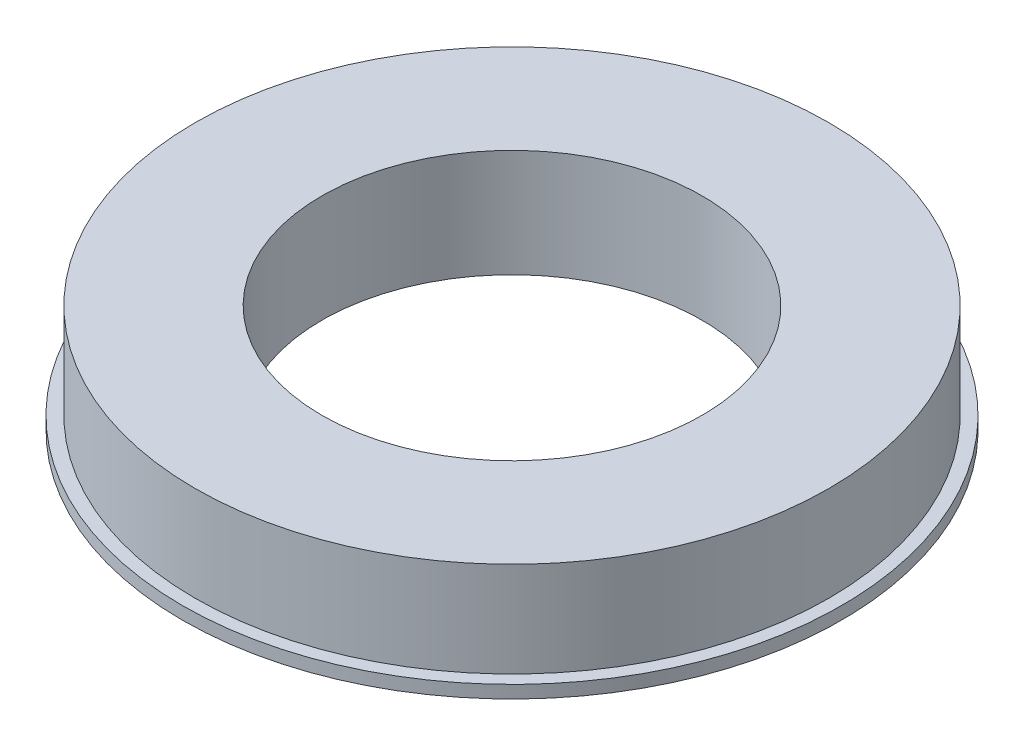
from build123d import *

# Parameters (mm, degrees)
SKETCH1_R           = 66.04
BOSS_EXTRUDE1_DEPTH = 2.54
SKETCH2_R           = 63.5
BOSS_EXTRUDE2_DEPTH = 19.05
SKETCH3_R           = 38.1
CUT_EXTRUDE1_DEPTH  = 96.857661666


with BuildPart() as part:
    # Sketch1 → Boss-Extrude1 (new body)
    with BuildSketch(Plane(origin=(0, 0, 0), x_dir=(1, 0, 0), z_dir=(0, 1, 0))):
        with Locations(Location((0, 0, 0), (0, 0, 270))):
            Circle(SKETCH1_R)
    extrude(amount=BOSS_EXTRUDE1_DEPTH)

    # Sketch2 → Boss-Extrude2 (add)
    with BuildSketch(Plane(origin=(0, 2.54, 0), x_dir=(1, 0, 0), z_dir=(0, 1, 0))):
        with Locations(Location((0, 0, 0), (0, 0, 90))):
            Circle(SKETCH2_R)
    extrude(amount=BOSS_EXTRUDE2_DEPTH)

    # Sketch3 → Cut-Extrude1 (cut, through all)
    with BuildSketch(Plane(origin=(0, 21.59, 0), x_dir=(1, 0, 0), z_dir=(0, 1, 0))):
        with Locations(Location((0, 0, 0), (0, 0, 270))):
            Circle(SKETCH3_R)
    extrude(amount=-CUT_EXTRUDE1_DEPTH, mode=Mode.SUBTRACT)


solid = part.part
